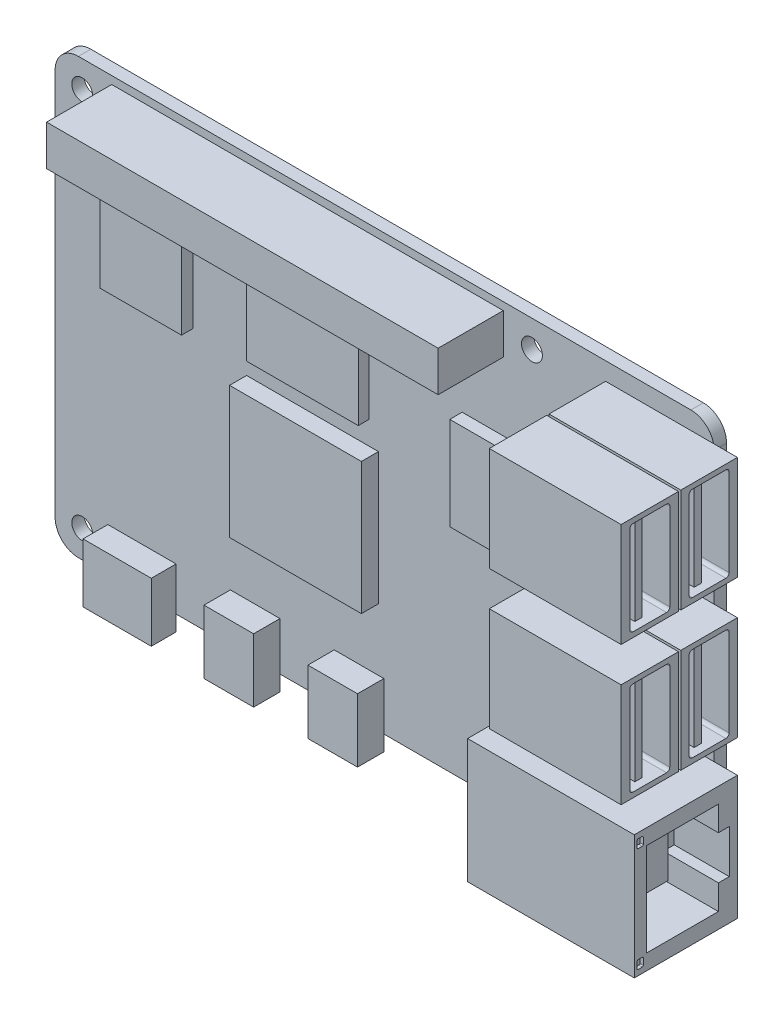
from build123d import *

# Parameters (mm, degrees)
PCB_LAMINATE_1P6_START                    = 5.5
PCB_85X56_R3_MOUNTPATTERN_R               = 1.35
PCB_LAMINATE_1P6_DEPTH                    = 1.6
USB_C_START                               = 7.1
USB_C_PROFILE_W                           = 8.8
USB_C_PROFILE_H                           = 7.6
USB_C_DEPTH                               = 3.2
MICRO_HDMI_1_START                        = 7.1
MICRO_HDMI_1_PROFILE_W                    = 6.4
MICRO_HDMI_1_PROFILE_H                    = 8.2
MICRO_HDMI_1_DEPTH                        = 3.4
MICRO_HDMI_2_START                        = 7.1
MICRO_HDMI_2_PROFILE_W                    = 6.4
MICRO_HDMI_2_PROFILE_H                    = 8.2
MICRO_HDMI_2_DEPTH                        = 3.4
RJ45_START                                = 7.1
RJ45_PROFILE_W                            = 21.5
RJ45_PROFILE_H                            = 16
RJ45_DEPTH                                = 13.3
USB_A_1_START                             = 7.1
USB_A_1_PROFILE_W                         = 17
USB_A_1_PROFILE_H                         = 13.4
USB_A_1_DEPTH                             = 7.3
USB_A_2_START                             = 14.7
USB_A_2_PROFILE_W                         = 17
USB_A_2_PROFILE_H                         = 13.4
USB_A_2_DEPTH                             = 7.4
USB_A_3_START                             = 7.1
USB_A_3_PROFILE_W                         = 17
USB_A_3_PROFILE_H                         = 13.4
USB_A_3_DEPTH                             = 7.3
USB_A_4_START                             = 14.7
USB_A_4_PROFILE_W                         = 17
USB_A_4_PROFILE_H                         = 13.4
USB_A_4_DEPTH                             = 7.4
BCM2712_START                             = 7.1
BCM2712_PROFILE_W                         = 17
BCM2712_PROFILE_H                         = 17
BCM2712_DEPTH                             = 2.2
RAM_START                                 = 7.1
RAM_PROFILE_W                             = 14.4
RAM_PROFILE_H                             = 10.1
RAM_DEPTH                                 = 1.4
RP1_START                                 = 7.1
RP1_PROFILE_W                             = 12
RP1_PROFILE_H                             = 12
RP1_DEPTH                                 = 1.6
POWER_IC_START                            = 7.1
POWER_IC_PROFILE_W                        = 10.5
POWER_IC_PROFILE_H                        = 13
POWER_IC_DEPTH                            = 1.5
GPIO_HEADER_START                         = 7.1
GPIO_HEADER_PROFILE_W                     = 50.5
GPIO_HEADER_PROFILE_H                     = 5.2
GPIO_HEADER_DEPTH                         = 8.4
DETAIL_USB_C_RECEPTACLE_START             = -30.08
DETAIL_USB_C_RECEPTACLE_DEPTH             = 4.45
DETAIL_MICRO_HDMI_KEYED_RECEPTACLES_START = -30.08
DETAIL_MICRO_HDMI_KEYED_RECEPTACLES_DEPTH = 4.35
DETAIL_USB_A_FOUR_RECEPTACLES_START       = 45.58
DETAIL_USB_A_FOUR_RECEPTACLES_DEPTH       = 6.28
DETAIL_RJ45_KEYED_RECEPTACLE_START        = 45.58
DETAIL_RJ45_KEYED_RECEPTACLE_DEPTH        = 7.18
DETAIL_RJ45_LED_POCKETS_START             = 45.58
DETAIL_RJ45_LED_POCKETS_DEPTH             = 1.12
USB_C_INSULATED_TONGUE_START              = 8.44
USB_C_INSULATED_TONGUE_PROFILE_W          = 5.52
USB_C_INSULATED_TONGUE_PROFILE_H          = 3.73
USB_C_INSULATED_TONGUE_DEPTH              = 0.52
USB_C_GOLD_CONTACT_ROW_START              = 8.96
USB_C_GOLD_CONTACT_ROW_PROFILE_W          = 0.24
USB_C_GOLD_CONTACT_ROW_PROFILE_H          = 1.71
USB_C_GOLD_CONTACT_ROW_DEPTH              = 0.08
USB_C_GOLD_CONTACT_ROW_2_DEPTH            = 0.08
USB_C_GOLD_CONTACT_ROW_3_DEPTH            = 0.08
USB_C_GOLD_CONTACT_ROW_4_DEPTH            = 0.08
USB_C_GOLD_CONTACT_ROW_5_DEPTH            = 0.08
USB_C_GOLD_CONTACT_ROW_6_DEPTH            = 0.08
USB_C_GOLD_CONTACT_ROW_7_DEPTH            = 0.08
USB_C_GOLD_CONTACT_ROW_8_DEPTH            = 0.08
MICRO_HDMI_1_TONGUE_START                 = 8.49
MICRO_HDMI_1_TONGUE_PROFILE_W             = 3.76
MICRO_HDMI_1_TONGUE_PROFILE_H             = 3.43
MICRO_HDMI_1_TONGUE_DEPTH                 = 0.43
MICRO_HDMI_2_TONGUE_START                 = 8.49
MICRO_HDMI_2_TONGUE_PROFILE_W             = 3.76
MICRO_HDMI_2_TONGUE_PROFILE_H             = 3.43
MICRO_HDMI_2_TONGUE_DEPTH                 = 0.43
MICRO_HDMI_GOLD_CONTACT_ROWS_START        = 8.92
MICRO_HDMI_GOLD_CONTACT_ROWS_PROFILE_W    = 0.19
MICRO_HDMI_GOLD_CONTACT_ROWS_PROFILE_H    = 1.67
MICRO_HDMI_GOLD_CONTACT_ROWS_DEPTH        = 0.065
MICRO_HDMI_GOLD_CONTACT_ROWS_2_DEPTH      = 0.065
MICRO_HDMI_GOLD_CONTACT_ROWS_3_DEPTH      = 0.065
MICRO_HDMI_GOLD_CONTACT_ROWS_4_DEPTH      = 0.065
MICRO_HDMI_GOLD_CONTACT_ROWS_5_DEPTH      = 0.065
MICRO_HDMI_GOLD_CONTACT_ROWS_6_DEPTH      = 0.065
MICRO_HDMI_GOLD_CONTACT_ROWS_7_DEPTH      = 0.065
MICRO_HDMI_GOLD_CONTACT_ROWS_8_DEPTH      = 0.065
MICRO_HDMI_GOLD_CONTACT_ROWS_9_DEPTH      = 0.065
MICRO_HDMI_GOLD_CONTACT_ROWS_10_DEPTH     = 0.065
MICRO_HDMI_GOLD_CONTACT_ROWS_11_DEPTH     = 0.065
MICRO_HDMI_GOLD_CONTACT_ROWS_12_DEPTH     = 0.065
MICRO_HDMI_GOLD_CONTACT_ROWS_13_DEPTH     = 0.065
MICRO_HDMI_GOLD_CONTACT_ROWS_14_DEPTH     = 0.065
USB_A_1_INSULATED_TONGUE_START            = 11.16
USB_A_1_INSULATED_TONGUE_PROFILE_W        = 5.52
USB_A_1_INSULATED_TONGUE_PROFILE_H        = 11.24
USB_A_1_INSULATED_TONGUE_DEPTH            = 0.92
USB_A_1_GOLD_CONTACT_ROW_START            = 11.05
USB_A_1_GOLD_CONTACT_ROW_PROFILE_W        = 2.2
USB_A_1_GOLD_CONTACT_ROW_PROFILE_H        = 0.7
USB_A_1_GOLD_CONTACT_ROW_DEPTH            = 0.11
USB_A_1_GOLD_CONTACT_ROW_2_DEPTH          = 0.11
USB_A_1_GOLD_CONTACT_ROW_3_DEPTH          = 0.11
USB_A_1_GOLD_CONTACT_ROW_4_DEPTH          = 0.11
USB_A_2_INSULATED_TONGUE_START            = 18.81
USB_A_2_INSULATED_TONGUE_PROFILE_W        = 5.52
USB_A_2_INSULATED_TONGUE_PROFILE_H        = 11.24
USB_A_2_INSULATED_TONGUE_DEPTH            = 0.92
USB_A_2_GOLD_CONTACT_ROW_START            = 18.7
USB_A_2_GOLD_CONTACT_ROW_PROFILE_W        = 2.2
USB_A_2_GOLD_CONTACT_ROW_PROFILE_H        = 0.7
USB_A_2_GOLD_CONTACT_ROW_DEPTH            = 0.11
USB_A_2_GOLD_CONTACT_ROW_2_DEPTH          = 0.11
USB_A_2_GOLD_CONTACT_ROW_3_DEPTH          = 0.11
USB_A_2_GOLD_CONTACT_ROW_4_DEPTH          = 0.11
USB_A_3_INSULATED_TONGUE_START            = 11.16
USB_A_3_INSULATED_TONGUE_PROFILE_W        = 5.52
USB_A_3_INSULATED_TONGUE_PROFILE_H        = 11.24
USB_A_3_INSULATED_TONGUE_DEPTH            = 0.92
USB_A_3_GOLD_CONTACT_ROW_START            = 11.05
USB_A_3_GOLD_CONTACT_ROW_PROFILE_W        = 2.2
USB_A_3_GOLD_CONTACT_ROW_PROFILE_H        = 0.7
USB_A_3_GOLD_CONTACT_ROW_DEPTH            = 0.11
USB_A_3_GOLD_CONTACT_ROW_2_DEPTH          = 0.11
USB_A_3_GOLD_CONTACT_ROW_3_DEPTH          = 0.11
USB_A_3_GOLD_CONTACT_ROW_4_DEPTH          = 0.11
USB_A_4_INSULATED_TONGUE_START            = 18.81
USB_A_4_INSULATED_TONGUE_PROFILE_W        = 5.52
USB_A_4_INSULATED_TONGUE_PROFILE_H        = 11.24
USB_A_4_INSULATED_TONGUE_DEPTH            = 0.92
USB_A_4_GOLD_CONTACT_ROW_START            = 18.7
USB_A_4_GOLD_CONTACT_ROW_PROFILE_W        = 2.2
USB_A_4_GOLD_CONTACT_ROW_PROFILE_H        = 0.7
USB_A_4_GOLD_CONTACT_ROW_DEPTH            = 0.11
USB_A_4_GOLD_CONTACT_ROW_2_DEPTH          = 0.11
USB_A_4_GOLD_CONTACT_ROW_3_DEPTH          = 0.11
USB_A_4_GOLD_CONTACT_ROW_4_DEPTH          = 0.11
RJ45_DARK_BACKPIECE_START                 = 9.62
RJ45_DARK_BACKPIECE_PROFILE_W             = 0.62
RJ45_DARK_BACKPIECE_PROFILE_H             = 11.5
RJ45_DARK_BACKPIECE_DEPTH                 = 9.06
RJ45_CONTACT_CARRIER_START                = 17.75
RJ45_CONTACT_CARRIER_PROFILE_W            = 4.93
RJ45_CONTACT_CARRIER_PROFILE_H            = 10
RJ45_CONTACT_CARRIER_DEPTH                = 0.7
RJ45_EIGHT_GOLD_CONTACTS_START            = 17.6
RJ45_EIGHT_GOLD_CONTACTS_PROFILE_W        = 4.18
RJ45_EIGHT_GOLD_CONTACTS_PROFILE_H        = 0.31
RJ45_EIGHT_GOLD_CONTACTS_DEPTH            = 0.15
RJ45_EIGHT_GOLD_CONTACTS_2_DEPTH          = 0.15
RJ45_EIGHT_GOLD_CONTACTS_3_DEPTH          = 0.15
RJ45_EIGHT_GOLD_CONTACTS_4_DEPTH          = 0.15
RJ45_EIGHT_GOLD_CONTACTS_5_DEPTH          = 0.15
RJ45_EIGHT_GOLD_CONTACTS_6_DEPTH          = 0.15
RJ45_EIGHT_GOLD_CONTACTS_7_DEPTH          = 0.15
RJ45_EIGHT_GOLD_CONTACTS_8_DEPTH          = 0.15
RJ45_GREEN_INDICATOR_START                = 19.37
RJ45_GREEN_INDICATOR_PROFILE_W            = 0.63
RJ45_GREEN_INDICATOR_PROFILE_H            = 0.86
RJ45_GREEN_INDICATOR_DEPTH                = 0.54
RJ45_AMBER_INDICATOR_START                = 19.37
RJ45_AMBER_INDICATOR_PROFILE_W            = 0.63
RJ45_AMBER_INDICATOR_PROFILE_H            = 0.86
RJ45_AMBER_INDICATOR_DEPTH                = 0.54


with BuildPart() as part:
    # PCB_85x56_R3_MountPattern → PCB_Laminate_1p6 (new body)
    with BuildSketch(Plane.XY.offset(PCB_LAMINATE_1P6_START)):
        with BuildLine():
            Line((-39.5, -28), (39.5, -28))
            ThreePointArc((39.5, -28), (41.621320344, -27.121320344), (42.5, -25))
            Line((42.5, -25), (42.5, 25))
            ThreePointArc((42.5, 25), (41.621320344, 27.121320344), (39.5, 28))
            Line((39.5, 28), (-39.5, 28))
            ThreePointArc((-39.5, 28), (-41.621320344, 27.121320344), (-42.5, 25))
            Line((-42.5, 25), (-42.5, -25))
            ThreePointArc((-42.5, -25), (-41.621320344, -27.121320344), (-39.5, -28))
        make_face()
        with Locations((-39, -24.5)):
            Circle(PCB_85X56_R3_MOUNTPATTERN_R, mode=Mode.SUBTRACT)
        with Locations((-39, 24.5)):
            Circle(PCB_85X56_R3_MOUNTPATTERN_R, mode=Mode.SUBTRACT)
        with Locations((19, -24.5)):
            Circle(PCB_85X56_R3_MOUNTPATTERN_R, mode=Mode.SUBTRACT)
        with Locations((19, 24.5)):
            Circle(PCB_85X56_R3_MOUNTPATTERN_R, mode=Mode.SUBTRACT)
    extrude(amount=PCB_LAMINATE_1P6_DEPTH)


with BuildPart() as body_2:
    # USB_C_Profile → USB_C (new body)
    with BuildSketch(Plane.XY.offset(USB_C_START)):
        with Locations((-31.3, -26.2)):
            Rectangle(USB_C_PROFILE_W, USB_C_PROFILE_H)
    extrude(amount=USB_C_DEPTH)

    # Detail_USB_C_Receptacle_Profile → Detail_USB_C_Receptacle (cut)
    with BuildSketch(Plane(origin=(0, 0, 0), x_dir=(1, 0, 0), z_dir=(0, 1, 0)).offset(DETAIL_USB_C_RECEPTACLE_START)):
        with BuildLine():
            Line((-34.04, -9.88), (-28.56, -9.88))
            ThreePointArc((-28.56, -9.88), (-27.753898269, -9.546101731), (-27.42, -8.74))
            Line((-27.42, -8.74), (-27.42, -8.66))
            ThreePointArc((-27.42, -8.66), (-27.753898269, -7.853898269), (-28.56, -7.52))
            Line((-28.56, -7.52), (-34.04, -7.52))
            ThreePointArc((-34.04, -7.52), (-34.846101731, -7.853898269), (-35.18, -8.66))
            Line((-35.18, -8.66), (-35.18, -8.74))
            ThreePointArc((-35.18, -8.74), (-34.846101731, -9.546101731), (-34.04, -9.88))
        make_face()
    extrude(amount=DETAIL_USB_C_RECEPTACLE_DEPTH, mode=Mode.SUBTRACT)


with BuildPart() as body_3:
    # Micro_HDMI_1_Profile → Micro_HDMI_1 (new body)
    with BuildSketch(Plane.XY.offset(MICRO_HDMI_1_START)):
        with Locations((-16.7, -25.9)):
            Rectangle(MICRO_HDMI_1_PROFILE_W, MICRO_HDMI_1_PROFILE_H)
    extrude(amount=MICRO_HDMI_1_DEPTH)


with BuildPart() as body_4:
    # Micro_HDMI_2_Profile → Micro_HDMI_2 (new body)
    with BuildSketch(Plane.XY.offset(MICRO_HDMI_2_START)):
        with Locations((-3.3, -25.9)):
            Rectangle(MICRO_HDMI_2_PROFILE_W, MICRO_HDMI_2_PROFILE_H)
    extrude(amount=MICRO_HDMI_2_DEPTH)


with BuildPart() as body_5:
    # RJ45_Profile → RJ45 (new body)
    with BuildSketch(Plane.XY.offset(RJ45_START)):
        with Locations((34.75, -17.8)):
            Rectangle(RJ45_PROFILE_W, RJ45_PROFILE_H)
    extrude(amount=RJ45_DEPTH)

    # Detail_RJ45_Keyed_Receptacle_Profile → Detail_RJ45_Keyed_Receptacle (cut)
    with BuildSketch(Plane(origin=(0, 0, 0), x_dir=(0, 0, -1), z_dir=(1, 0, 0)).offset(DETAIL_RJ45_KEYED_RECEPTACLE_START)):
        Polygon((-18.8, -23.8), (-18.8, -11.8), (-9.55, -11.8), (-9.55, -15), (-8.15, -15), (-8.15, -20.6), (-9.55, -20.6), (-9.55, -23.8), align=None)
    extrude(amount=-DETAIL_RJ45_KEYED_RECEPTACLE_DEPTH, mode=Mode.SUBTRACT)

    # Detail_RJ45_LED_Pockets_Profile → Detail_RJ45_LED_Pockets (cut)
    with BuildSketch(Plane(origin=(0, 0, 0), x_dir=(0, 0, -1), z_dir=(1, 0, 0)).offset(DETAIL_RJ45_LED_POCKETS_START)):
        with BuildLine():
            Line((-19.9, -25.1), (-19.38, -25.1))
            ThreePointArc((-19.38, -25.1), (-19.281005051, -25.058994949), (-19.24, -24.96))
            Line((-19.24, -24.96), (-19.24, -24.14))
            ThreePointArc((-19.24, -24.14), (-19.281005051, -24.041005051), (-19.38, -24))
            Line((-19.38, -24), (-19.9, -24))
            ThreePointArc((-19.9, -24), (-19.998994949, -24.041005051), (-20.04, -24.14))
            Line((-20.04, -24.14), (-20.04, -24.96))
            ThreePointArc((-20.04, -24.96), (-19.998994949, -25.058994949), (-19.9, -25.1))
        make_face()
        with BuildLine():
            Line((-19.9, -11.6), (-19.38, -11.6))
            ThreePointArc((-19.38, -11.6), (-19.281005051, -11.558994949), (-19.24, -11.46))
            Line((-19.24, -11.46), (-19.24, -10.64))
            ThreePointArc((-19.24, -10.64), (-19.281005051, -10.541005051), (-19.38, -10.5))
            Line((-19.38, -10.5), (-19.9, -10.5))
            ThreePointArc((-19.9, -10.5), (-19.998994949, -10.541005051), (-20.04, -10.64))
            Line((-20.04, -10.64), (-20.04, -11.46))
            ThreePointArc((-20.04, -11.46), (-19.998994949, -11.558994949), (-19.9, -11.6))
        make_face()
    extrude(amount=-DETAIL_RJ45_LED_POCKETS_DEPTH, mode=Mode.SUBTRACT)


with BuildPart() as body_6:
    # USB_A_1_Profile → USB_A_1 (new body)
    with BuildSketch(Plane.XY.offset(USB_A_1_START)):
        with Locations((37, 1.1)):
            Rectangle(USB_A_1_PROFILE_W, USB_A_1_PROFILE_H)
    extrude(amount=USB_A_1_DEPTH)


with BuildPart() as body_7:
    # USB_A_2_Profile → USB_A_2 (new body)
    with BuildSketch(Plane.XY.offset(USB_A_2_START)):
        with Locations((37, 1.1)):
            Rectangle(USB_A_2_PROFILE_W, USB_A_2_PROFILE_H)
    extrude(amount=USB_A_2_DEPTH)


with BuildPart() as body_8:
    # USB_A_3_Profile → USB_A_3 (new body)
    with BuildSketch(Plane.XY.offset(USB_A_3_START)):
        with Locations((37, 19)):
            Rectangle(USB_A_3_PROFILE_W, USB_A_3_PROFILE_H)
    extrude(amount=USB_A_3_DEPTH)


with BuildPart() as body_9:
    # USB_A_4_Profile → USB_A_4 (new body)
    with BuildSketch(Plane.XY.offset(USB_A_4_START)):
        with Locations((37, 19)):
            Rectangle(USB_A_4_PROFILE_W, USB_A_4_PROFILE_H)
    extrude(amount=USB_A_4_DEPTH)


with BuildPart() as body_10:
    # BCM2712_Profile → BCM2712 (new body)
    with BuildSketch(Plane.XY.offset(BCM2712_START)):
        with Locations((-9.3, -5.3)):
            Rectangle(BCM2712_PROFILE_W, BCM2712_PROFILE_H)
    extrude(amount=BCM2712_DEPTH)


with BuildPart() as body_11:
    # RAM_Profile → RAM (new body)
    with BuildSketch(Plane.XY.offset(RAM_START)):
        with Locations((-9.2, 11.25)):
            Rectangle(RAM_PROFILE_W, RAM_PROFILE_H)
    extrude(amount=RAM_DEPTH)


with BuildPart() as body_12:
    # RP1_Profile → RP1 (new body)
    with BuildSketch(Plane.XY.offset(RP1_START)):
        with Locations((16, 7)):
            Rectangle(RP1_PROFILE_W, RP1_PROFILE_H)
    extrude(amount=RP1_DEPTH)


with BuildPart() as body_13:
    # Power_IC_Profile → Power_IC (new body)
    with BuildSketch(Plane.XY.offset(POWER_IC_START)):
        with Locations((-29.95, 11.5)):
            Rectangle(POWER_IC_PROFILE_W, POWER_IC_PROFILE_H)
    extrude(amount=POWER_IC_DEPTH)


with BuildPart() as body_14:
    # GPIO_Header_Profile → GPIO_Header (new body)
    with BuildSketch(Plane.XY.offset(GPIO_HEADER_START)):
        with Locations((-9.95, 24.4)):
            Rectangle(GPIO_HEADER_PROFILE_W, GPIO_HEADER_PROFILE_H)
    extrude(amount=GPIO_HEADER_DEPTH)


with BuildPart() as detail_micro_hdmi_keyed_receptacles_tool:
    # Detail_Micro_HDMI_Keyed_Receptacles_Profile → Detail_Micro_HDMI_Keyed_Receptacles (new body)
    with BuildSketch(Plane(origin=(0, 0, 0), x_dir=(1, 0, 0), z_dir=(0, 1, 0)).offset(DETAIL_MICRO_HDMI_KEYED_RECEPTACLES_START)):
        Polygon((-19.45, -9.95), (-13.95, -9.95), (-13.95, -8.48), (-14.58, -7.65), (-18.82, -7.65), (-19.45, -8.48), align=None)
        Polygon((-6.05, -9.95), (-0.55, -9.95), (-0.55, -8.48), (-1.18, -7.65), (-5.42, -7.65), (-6.05, -8.48), align=None)
    extrude(amount=DETAIL_MICRO_HDMI_KEYED_RECEPTACLES_DEPTH)


with BuildPart() as body_3_1:
    add(body_3.part)

    # Detail_Micro_HDMI_Keyed_Receptacles: cut by detail_micro_hdmi_keyed_receptacles_tool
    add(detail_micro_hdmi_keyed_receptacles_tool.part, mode=Mode.SUBTRACT)


with BuildPart() as body_4_1:
    add(body_4.part)

    # Detail_Micro_HDMI_Keyed_Receptacles: cut by detail_micro_hdmi_keyed_receptacles_tool
    add(detail_micro_hdmi_keyed_receptacles_tool.part, mode=Mode.SUBTRACT)


with BuildPart() as detail_usb_a_four_receptacles_tool:
    # Detail_USB_A_Four_Receptacles_Profile → Detail_USB_A_Four_Receptacles (new body)
    with BuildSketch(Plane(origin=(0, 0, 0), x_dir=(0, 0, -1), z_dir=(1, 0, 0)).offset(DETAIL_USB_A_FOUR_RECEPTACLES_START)):
        with BuildLine():
            Line((-12.91, -4.95), (-8.59, -4.95))
            ThreePointArc((-8.59, -4.95), (-8.293015152, -4.826984848), (-8.17, -4.53))
            Line((-8.17, -4.53), (-8.17, 6.73))
            ThreePointArc((-8.17, 6.73), (-8.293015152, 7.026984848), (-8.59, 7.15))
            Line((-8.59, 7.15), (-12.91, 7.15))
            ThreePointArc((-12.91, 7.15), (-13.206984848, 7.026984848), (-13.33, 6.73))
            Line((-13.33, 6.73), (-13.33, -4.53))
            ThreePointArc((-13.33, -4.53), (-13.206984848, -4.826984848), (-12.91, -4.95))
        make_face()
        with BuildLine():
            Line((-20.56, -4.95), (-16.24, -4.95))
            ThreePointArc((-16.24, -4.95), (-15.943015152, -4.826984848), (-15.82, -4.53))
            Line((-15.82, -4.53), (-15.82, 6.73))
            ThreePointArc((-15.82, 6.73), (-15.943015152, 7.026984848), (-16.24, 7.15))
            Line((-16.24, 7.15), (-20.56, 7.15))
            ThreePointArc((-20.56, 7.15), (-20.856984848, 7.026984848), (-20.98, 6.73))
            Line((-20.98, 6.73), (-20.98, -4.53))
            ThreePointArc((-20.98, -4.53), (-20.856984848, -4.826984848), (-20.56, -4.95))
        make_face()
        with BuildLine():
            Line((-12.91, 12.95), (-8.59, 12.95))
            ThreePointArc((-8.59, 12.95), (-8.293015152, 13.073015152), (-8.17, 13.37))
            Line((-8.17, 13.37), (-8.17, 24.63))
            ThreePointArc((-8.17, 24.63), (-8.293015152, 24.926984848), (-8.59, 25.05))
            Line((-8.59, 25.05), (-12.91, 25.05))
            ThreePointArc((-12.91, 25.05), (-13.206984848, 24.926984848), (-13.33, 24.63))
            Line((-13.33, 24.63), (-13.33, 13.37))
            ThreePointArc((-13.33, 13.37), (-13.206984848, 13.073015152), (-12.91, 12.95))
        make_face()
        with BuildLine():
            Line((-20.56, 12.95), (-16.24, 12.95))
            ThreePointArc((-16.24, 12.95), (-15.943015152, 13.073015152), (-15.82, 13.37))
            Line((-15.82, 13.37), (-15.82, 24.63))
            ThreePointArc((-15.82, 24.63), (-15.943015152, 24.926984848), (-16.24, 25.05))
            Line((-16.24, 25.05), (-20.56, 25.05))
            ThreePointArc((-20.56, 25.05), (-20.856984848, 24.926984848), (-20.98, 24.63))
            Line((-20.98, 24.63), (-20.98, 13.37))
            ThreePointArc((-20.98, 13.37), (-20.856984848, 13.073015152), (-20.56, 12.95))
        make_face()
    extrude(amount=-DETAIL_USB_A_FOUR_RECEPTACLES_DEPTH)


with BuildPart() as body_6_1:
    add(body_6.part)

    # Detail_USB_A_Four_Receptacles: cut by detail_usb_a_four_receptacles_tool
    add(detail_usb_a_four_receptacles_tool.part, mode=Mode.SUBTRACT)


with BuildPart() as body_7_1:
    add(body_7.part)

    # Detail_USB_A_Four_Receptacles: cut by detail_usb_a_four_receptacles_tool
    add(detail_usb_a_four_receptacles_tool.part, mode=Mode.SUBTRACT)


with BuildPart() as body_8_1:
    add(body_8.part)

    # Detail_USB_A_Four_Receptacles: cut by detail_usb_a_four_receptacles_tool
    add(detail_usb_a_four_receptacles_tool.part, mode=Mode.SUBTRACT)


with BuildPart() as body_9_1:
    add(body_9.part)

    # Detail_USB_A_Four_Receptacles: cut by detail_usb_a_four_receptacles_tool
    add(detail_usb_a_four_receptacles_tool.part, mode=Mode.SUBTRACT)


with BuildPart() as body_15:
    # USB_C_Insulated_Tongue_Profile → USB_C_Insulated_Tongue (new body)
    with BuildSketch(Plane.XY.offset(USB_C_INSULATED_TONGUE_START)):
        with Locations((-31.3, -27.505)):
            Rectangle(USB_C_INSULATED_TONGUE_PROFILE_W, USB_C_INSULATED_TONGUE_PROFILE_H)
    extrude(amount=USB_C_INSULATED_TONGUE_DEPTH)


with BuildPart() as body_16:
    # USB_C_Gold_Contact_Row_Profile → USB_C_Gold_Contact_Row (new body)
    with BuildSketch(Plane.XY.offset(USB_C_GOLD_CONTACT_ROW_START)):
        with Locations((-33.365, -28.095)):
            Rectangle(USB_C_GOLD_CONTACT_ROW_PROFILE_W, USB_C_GOLD_CONTACT_ROW_PROFILE_H)
    extrude(amount=USB_C_GOLD_CONTACT_ROW_DEPTH)


with BuildPart() as body_17:
    # USB_C_Gold_Contact_Row_Profile → USB_C_Gold_Contact_Row 2 (new body)
    with BuildSketch(Plane.XY.offset(USB_C_GOLD_CONTACT_ROW_START)):
        with Locations((-32.775, -28.095)):
            Rectangle(USB_C_GOLD_CONTACT_ROW_PROFILE_W, USB_C_GOLD_CONTACT_ROW_PROFILE_H)
    extrude(amount=USB_C_GOLD_CONTACT_ROW_2_DEPTH)


with BuildPart() as body_18:
    # USB_C_Gold_Contact_Row_Profile → USB_C_Gold_Contact_Row 3 (new body)
    with BuildSketch(Plane.XY.offset(USB_C_GOLD_CONTACT_ROW_START)):
        with Locations((-32.185, -28.095)):
            Rectangle(USB_C_GOLD_CONTACT_ROW_PROFILE_W, USB_C_GOLD_CONTACT_ROW_PROFILE_H)
    extrude(amount=USB_C_GOLD_CONTACT_ROW_3_DEPTH)


with BuildPart() as body_19:
    # USB_C_Gold_Contact_Row_Profile → USB_C_Gold_Contact_Row 4 (new body)
    with BuildSketch(Plane.XY.offset(USB_C_GOLD_CONTACT_ROW_START)):
        with Locations((-31.595, -28.095)):
            Rectangle(USB_C_GOLD_CONTACT_ROW_PROFILE_W, USB_C_GOLD_CONTACT_ROW_PROFILE_H)
    extrude(amount=USB_C_GOLD_CONTACT_ROW_4_DEPTH)


with BuildPart() as body_20:
    # USB_C_Gold_Contact_Row_Profile → USB_C_Gold_Contact_Row 5 (new body)
    with BuildSketch(Plane.XY.offset(USB_C_GOLD_CONTACT_ROW_START)):
        with Locations((-31.005, -28.095)):
            Rectangle(USB_C_GOLD_CONTACT_ROW_PROFILE_W, USB_C_GOLD_CONTACT_ROW_PROFILE_H)
    extrude(amount=USB_C_GOLD_CONTACT_ROW_5_DEPTH)


with BuildPart() as body_21:
    # USB_C_Gold_Contact_Row_Profile → USB_C_Gold_Contact_Row 6 (new body)
    with BuildSketch(Plane.XY.offset(USB_C_GOLD_CONTACT_ROW_START)):
        with Locations((-30.415, -28.095)):
            Rectangle(USB_C_GOLD_CONTACT_ROW_PROFILE_W, USB_C_GOLD_CONTACT_ROW_PROFILE_H)
    extrude(amount=USB_C_GOLD_CONTACT_ROW_6_DEPTH)


with BuildPart() as body_22:
    # USB_C_Gold_Contact_Row_Profile → USB_C_Gold_Contact_Row 7 (new body)
    with BuildSketch(Plane.XY.offset(USB_C_GOLD_CONTACT_ROW_START)):
        with Locations((-29.825, -28.095)):
            Rectangle(USB_C_GOLD_CONTACT_ROW_PROFILE_W, USB_C_GOLD_CONTACT_ROW_PROFILE_H)
    extrude(amount=USB_C_GOLD_CONTACT_ROW_7_DEPTH)


with BuildPart() as body_23:
    # USB_C_Gold_Contact_Row_Profile → USB_C_Gold_Contact_Row 8 (new body)
    with BuildSketch(Plane.XY.offset(USB_C_GOLD_CONTACT_ROW_START)):
        with Locations((-29.235, -28.095)):
            Rectangle(USB_C_GOLD_CONTACT_ROW_PROFILE_W, USB_C_GOLD_CONTACT_ROW_PROFILE_H)
    extrude(amount=USB_C_GOLD_CONTACT_ROW_8_DEPTH)


with BuildPart() as body_24:
    # Micro_HDMI_1_Tongue_Profile → Micro_HDMI_1_Tongue (new body)
    with BuildSketch(Plane.XY.offset(MICRO_HDMI_1_TONGUE_START)):
        with Locations((-16.7, -27.465)):
            Rectangle(MICRO_HDMI_1_TONGUE_PROFILE_W, MICRO_HDMI_1_TONGUE_PROFILE_H)
    extrude(amount=MICRO_HDMI_1_TONGUE_DEPTH)


with BuildPart() as body_25:
    # Micro_HDMI_2_Tongue_Profile → Micro_HDMI_2_Tongue (new body)
    with BuildSketch(Plane.XY.offset(MICRO_HDMI_2_TONGUE_START)):
        with Locations((-3.3, -27.465)):
            Rectangle(MICRO_HDMI_2_TONGUE_PROFILE_W, MICRO_HDMI_2_TONGUE_PROFILE_H)
    extrude(amount=MICRO_HDMI_2_TONGUE_DEPTH)


with BuildPart() as body_26:
    # Micro_HDMI_Gold_Contact_Rows_Profile → Micro_HDMI_Gold_Contact_Rows (new body)
    with BuildSketch(Plane.XY.offset(MICRO_HDMI_GOLD_CONTACT_ROWS_START)):
        with Locations((-18.11, -28.085)):
            Rectangle(MICRO_HDMI_GOLD_CONTACT_ROWS_PROFILE_W, MICRO_HDMI_GOLD_CONTACT_ROWS_PROFILE_H)
    extrude(amount=MICRO_HDMI_GOLD_CONTACT_ROWS_DEPTH)


with BuildPart() as body_27:
    # Micro_HDMI_Gold_Contact_Rows_Profile → Micro_HDMI_Gold_Contact_Rows 2 (new body)
    with BuildSketch(Plane.XY.offset(MICRO_HDMI_GOLD_CONTACT_ROWS_START)):
        with Locations((-17.64, -28.085)):
            Rectangle(MICRO_HDMI_GOLD_CONTACT_ROWS_PROFILE_W, MICRO_HDMI_GOLD_CONTACT_ROWS_PROFILE_H)
    extrude(amount=MICRO_HDMI_GOLD_CONTACT_ROWS_2_DEPTH)


with BuildPart() as body_28:
    # Micro_HDMI_Gold_Contact_Rows_Profile → Micro_HDMI_Gold_Contact_Rows 3 (new body)
    with BuildSketch(Plane.XY.offset(MICRO_HDMI_GOLD_CONTACT_ROWS_START)):
        with Locations((-17.17, -28.085)):
            Rectangle(MICRO_HDMI_GOLD_CONTACT_ROWS_PROFILE_W, MICRO_HDMI_GOLD_CONTACT_ROWS_PROFILE_H)
    extrude(amount=MICRO_HDMI_GOLD_CONTACT_ROWS_3_DEPTH)


with BuildPart() as body_29:
    # Micro_HDMI_Gold_Contact_Rows_Profile → Micro_HDMI_Gold_Contact_Rows 4 (new body)
    with BuildSketch(Plane.XY.offset(MICRO_HDMI_GOLD_CONTACT_ROWS_START)):
        with Locations((-16.7, -28.085)):
            Rectangle(MICRO_HDMI_GOLD_CONTACT_ROWS_PROFILE_W, MICRO_HDMI_GOLD_CONTACT_ROWS_PROFILE_H)
    extrude(amount=MICRO_HDMI_GOLD_CONTACT_ROWS_4_DEPTH)


with BuildPart() as body_30:
    # Micro_HDMI_Gold_Contact_Rows_Profile → Micro_HDMI_Gold_Contact_Rows 5 (new body)
    with BuildSketch(Plane.XY.offset(MICRO_HDMI_GOLD_CONTACT_ROWS_START)):
        with Locations((-16.23, -28.085)):
            Rectangle(MICRO_HDMI_GOLD_CONTACT_ROWS_PROFILE_W, MICRO_HDMI_GOLD_CONTACT_ROWS_PROFILE_H)
    extrude(amount=MICRO_HDMI_GOLD_CONTACT_ROWS_5_DEPTH)


with BuildPart() as body_31:
    # Micro_HDMI_Gold_Contact_Rows_Profile → Micro_HDMI_Gold_Contact_Rows 6 (new body)
    with BuildSketch(Plane.XY.offset(MICRO_HDMI_GOLD_CONTACT_ROWS_START)):
        with Locations((-15.76, -28.085)):
            Rectangle(MICRO_HDMI_GOLD_CONTACT_ROWS_PROFILE_W, MICRO_HDMI_GOLD_CONTACT_ROWS_PROFILE_H)
    extrude(amount=MICRO_HDMI_GOLD_CONTACT_ROWS_6_DEPTH)


with BuildPart() as body_32:
    # Micro_HDMI_Gold_Contact_Rows_Profile → Micro_HDMI_Gold_Contact_Rows 7 (new body)
    with BuildSketch(Plane.XY.offset(MICRO_HDMI_GOLD_CONTACT_ROWS_START)):
        with Locations((-15.29, -28.085)):
            Rectangle(MICRO_HDMI_GOLD_CONTACT_ROWS_PROFILE_W, MICRO_HDMI_GOLD_CONTACT_ROWS_PROFILE_H)
    extrude(amount=MICRO_HDMI_GOLD_CONTACT_ROWS_7_DEPTH)


with BuildPart() as body_33:
    # Micro_HDMI_Gold_Contact_Rows_Profile → Micro_HDMI_Gold_Contact_Rows 8 (new body)
    with BuildSketch(Plane.XY.offset(MICRO_HDMI_GOLD_CONTACT_ROWS_START)):
        with Locations((-4.71, -28.085)):
            Rectangle(MICRO_HDMI_GOLD_CONTACT_ROWS_PROFILE_W, MICRO_HDMI_GOLD_CONTACT_ROWS_PROFILE_H)
    extrude(amount=MICRO_HDMI_GOLD_CONTACT_ROWS_8_DEPTH)


with BuildPart() as body_34:
    # Micro_HDMI_Gold_Contact_Rows_Profile → Micro_HDMI_Gold_Contact_Rows 9 (new body)
    with BuildSketch(Plane.XY.offset(MICRO_HDMI_GOLD_CONTACT_ROWS_START)):
        with Locations((-4.24, -28.085)):
            Rectangle(MICRO_HDMI_GOLD_CONTACT_ROWS_PROFILE_W, MICRO_HDMI_GOLD_CONTACT_ROWS_PROFILE_H)
    extrude(amount=MICRO_HDMI_GOLD_CONTACT_ROWS_9_DEPTH)


with BuildPart() as body_35:
    # Micro_HDMI_Gold_Contact_Rows_Profile → Micro_HDMI_Gold_Contact_Rows 10 (new body)
    with BuildSketch(Plane.XY.offset(MICRO_HDMI_GOLD_CONTACT_ROWS_START)):
        with Locations((-3.77, -28.085)):
            Rectangle(MICRO_HDMI_GOLD_CONTACT_ROWS_PROFILE_W, MICRO_HDMI_GOLD_CONTACT_ROWS_PROFILE_H)
    extrude(amount=MICRO_HDMI_GOLD_CONTACT_ROWS_10_DEPTH)


with BuildPart() as body_36:
    # Micro_HDMI_Gold_Contact_Rows_Profile → Micro_HDMI_Gold_Contact_Rows 11 (new body)
    with BuildSketch(Plane.XY.offset(MICRO_HDMI_GOLD_CONTACT_ROWS_START)):
        with Locations((-3.3, -28.085)):
            Rectangle(MICRO_HDMI_GOLD_CONTACT_ROWS_PROFILE_W, MICRO_HDMI_GOLD_CONTACT_ROWS_PROFILE_H)
    extrude(amount=MICRO_HDMI_GOLD_CONTACT_ROWS_11_DEPTH)


with BuildPart() as body_37:
    # Micro_HDMI_Gold_Contact_Rows_Profile → Micro_HDMI_Gold_Contact_Rows 12 (new body)
    with BuildSketch(Plane.XY.offset(MICRO_HDMI_GOLD_CONTACT_ROWS_START)):
        with Locations((-2.83, -28.085)):
            Rectangle(MICRO_HDMI_GOLD_CONTACT_ROWS_PROFILE_W, MICRO_HDMI_GOLD_CONTACT_ROWS_PROFILE_H)
    extrude(amount=MICRO_HDMI_GOLD_CONTACT_ROWS_12_DEPTH)


with BuildPart() as body_38:
    # Micro_HDMI_Gold_Contact_Rows_Profile → Micro_HDMI_Gold_Contact_Rows 13 (new body)
    with BuildSketch(Plane.XY.offset(MICRO_HDMI_GOLD_CONTACT_ROWS_START)):
        with Locations((-2.36, -28.085)):
            Rectangle(MICRO_HDMI_GOLD_CONTACT_ROWS_PROFILE_W, MICRO_HDMI_GOLD_CONTACT_ROWS_PROFILE_H)
    extrude(amount=MICRO_HDMI_GOLD_CONTACT_ROWS_13_DEPTH)


with BuildPart() as body_39:
    # Micro_HDMI_Gold_Contact_Rows_Profile → Micro_HDMI_Gold_Contact_Rows 14 (new body)
    with BuildSketch(Plane.XY.offset(MICRO_HDMI_GOLD_CONTACT_ROWS_START)):
        with Locations((-1.89, -28.085)):
            Rectangle(MICRO_HDMI_GOLD_CONTACT_ROWS_PROFILE_W, MICRO_HDMI_GOLD_CONTACT_ROWS_PROFILE_H)
    extrude(amount=MICRO_HDMI_GOLD_CONTACT_ROWS_14_DEPTH)


with BuildPart() as body_40:
    # USB_A_1_Insulated_Tongue_Profile → USB_A_1_Insulated_Tongue (new body)
    with BuildSketch(Plane.XY.offset(USB_A_1_INSULATED_TONGUE_START)):
        with Locations((42.14, 1.1)):
            Rectangle(USB_A_1_INSULATED_TONGUE_PROFILE_W, USB_A_1_INSULATED_TONGUE_PROFILE_H)
    extrude(amount=USB_A_1_INSULATED_TONGUE_DEPTH)


with BuildPart() as body_41:
    # USB_A_1_Gold_Contact_Row_Profile → USB_A_1_Gold_Contact_Row (new body)
    with BuildSketch(Plane.XY.offset(USB_A_1_GOLD_CONTACT_ROW_START)):
        with Locations((43.4, -1.99)):
            Rectangle(USB_A_1_GOLD_CONTACT_ROW_PROFILE_W, USB_A_1_GOLD_CONTACT_ROW_PROFILE_H)
    extrude(amount=USB_A_1_GOLD_CONTACT_ROW_DEPTH)


with BuildPart() as body_42:
    # USB_A_1_Gold_Contact_Row_Profile → USB_A_1_Gold_Contact_Row 2 (new body)
    with BuildSketch(Plane.XY.offset(USB_A_1_GOLD_CONTACT_ROW_START)):
        with Locations((43.4, 0.07)):
            Rectangle(USB_A_1_GOLD_CONTACT_ROW_PROFILE_W, USB_A_1_GOLD_CONTACT_ROW_PROFILE_H)
    extrude(amount=USB_A_1_GOLD_CONTACT_ROW_2_DEPTH)


with BuildPart() as body_43:
    # USB_A_1_Gold_Contact_Row_Profile → USB_A_1_Gold_Contact_Row 3 (new body)
    with BuildSketch(Plane.XY.offset(USB_A_1_GOLD_CONTACT_ROW_START)):
        with Locations((43.4, 2.13)):
            Rectangle(USB_A_1_GOLD_CONTACT_ROW_PROFILE_W, USB_A_1_GOLD_CONTACT_ROW_PROFILE_H)
    extrude(amount=USB_A_1_GOLD_CONTACT_ROW_3_DEPTH)


with BuildPart() as body_44:
    # USB_A_1_Gold_Contact_Row_Profile → USB_A_1_Gold_Contact_Row 4 (new body)
    with BuildSketch(Plane.XY.offset(USB_A_1_GOLD_CONTACT_ROW_START)):
        with Locations((43.4, 4.19)):
            Rectangle(USB_A_1_GOLD_CONTACT_ROW_PROFILE_W, USB_A_1_GOLD_CONTACT_ROW_PROFILE_H)
    extrude(amount=USB_A_1_GOLD_CONTACT_ROW_4_DEPTH)


with BuildPart() as body_45:
    # USB_A_2_Insulated_Tongue_Profile → USB_A_2_Insulated_Tongue (new body)
    with BuildSketch(Plane.XY.offset(USB_A_2_INSULATED_TONGUE_START)):
        with Locations((42.14, 1.1)):
            Rectangle(USB_A_2_INSULATED_TONGUE_PROFILE_W, USB_A_2_INSULATED_TONGUE_PROFILE_H)
    extrude(amount=USB_A_2_INSULATED_TONGUE_DEPTH)


with BuildPart() as body_46:
    # USB_A_2_Gold_Contact_Row_Profile → USB_A_2_Gold_Contact_Row (new body)
    with BuildSketch(Plane.XY.offset(USB_A_2_GOLD_CONTACT_ROW_START)):
        with Locations((43.4, -1.99)):
            Rectangle(USB_A_2_GOLD_CONTACT_ROW_PROFILE_W, USB_A_2_GOLD_CONTACT_ROW_PROFILE_H)
    extrude(amount=USB_A_2_GOLD_CONTACT_ROW_DEPTH)


with BuildPart() as body_47:
    # USB_A_2_Gold_Contact_Row_Profile → USB_A_2_Gold_Contact_Row 2 (new body)
    with BuildSketch(Plane.XY.offset(USB_A_2_GOLD_CONTACT_ROW_START)):
        with Locations((43.4, 0.07)):
            Rectangle(USB_A_2_GOLD_CONTACT_ROW_PROFILE_W, USB_A_2_GOLD_CONTACT_ROW_PROFILE_H)
    extrude(amount=USB_A_2_GOLD_CONTACT_ROW_2_DEPTH)


with BuildPart() as body_48:
    # USB_A_2_Gold_Contact_Row_Profile → USB_A_2_Gold_Contact_Row 3 (new body)
    with BuildSketch(Plane.XY.offset(USB_A_2_GOLD_CONTACT_ROW_START)):
        with Locations((43.4, 2.13)):
            Rectangle(USB_A_2_GOLD_CONTACT_ROW_PROFILE_W, USB_A_2_GOLD_CONTACT_ROW_PROFILE_H)
    extrude(amount=USB_A_2_GOLD_CONTACT_ROW_3_DEPTH)


with BuildPart() as body_49:
    # USB_A_2_Gold_Contact_Row_Profile → USB_A_2_Gold_Contact_Row 4 (new body)
    with BuildSketch(Plane.XY.offset(USB_A_2_GOLD_CONTACT_ROW_START)):
        with Locations((43.4, 4.19)):
            Rectangle(USB_A_2_GOLD_CONTACT_ROW_PROFILE_W, USB_A_2_GOLD_CONTACT_ROW_PROFILE_H)
    extrude(amount=USB_A_2_GOLD_CONTACT_ROW_4_DEPTH)


with BuildPart() as body_50:
    # USB_A_3_Insulated_Tongue_Profile → USB_A_3_Insulated_Tongue (new body)
    with BuildSketch(Plane.XY.offset(USB_A_3_INSULATED_TONGUE_START)):
        with Locations((42.14, 19)):
            Rectangle(USB_A_3_INSULATED_TONGUE_PROFILE_W, USB_A_3_INSULATED_TONGUE_PROFILE_H)
    extrude(amount=USB_A_3_INSULATED_TONGUE_DEPTH)


with BuildPart() as body_51:
    # USB_A_3_Gold_Contact_Row_Profile → USB_A_3_Gold_Contact_Row (new body)
    with BuildSketch(Plane.XY.offset(USB_A_3_GOLD_CONTACT_ROW_START)):
        with Locations((43.4, 15.91)):
            Rectangle(USB_A_3_GOLD_CONTACT_ROW_PROFILE_W, USB_A_3_GOLD_CONTACT_ROW_PROFILE_H)
    extrude(amount=USB_A_3_GOLD_CONTACT_ROW_DEPTH)


with BuildPart() as body_52:
    # USB_A_3_Gold_Contact_Row_Profile → USB_A_3_Gold_Contact_Row 2 (new body)
    with BuildSketch(Plane.XY.offset(USB_A_3_GOLD_CONTACT_ROW_START)):
        with Locations((43.4, 17.97)):
            Rectangle(USB_A_3_GOLD_CONTACT_ROW_PROFILE_W, USB_A_3_GOLD_CONTACT_ROW_PROFILE_H)
    extrude(amount=USB_A_3_GOLD_CONTACT_ROW_2_DEPTH)


with BuildPart() as body_53:
    # USB_A_3_Gold_Contact_Row_Profile → USB_A_3_Gold_Contact_Row 3 (new body)
    with BuildSketch(Plane.XY.offset(USB_A_3_GOLD_CONTACT_ROW_START)):
        with Locations((43.4, 20.03)):
            Rectangle(USB_A_3_GOLD_CONTACT_ROW_PROFILE_W, USB_A_3_GOLD_CONTACT_ROW_PROFILE_H)
    extrude(amount=USB_A_3_GOLD_CONTACT_ROW_3_DEPTH)


with BuildPart() as body_54:
    # USB_A_3_Gold_Contact_Row_Profile → USB_A_3_Gold_Contact_Row 4 (new body)
    with BuildSketch(Plane.XY.offset(USB_A_3_GOLD_CONTACT_ROW_START)):
        with Locations((43.4, 22.09)):
            Rectangle(USB_A_3_GOLD_CONTACT_ROW_PROFILE_W, USB_A_3_GOLD_CONTACT_ROW_PROFILE_H)
    extrude(amount=USB_A_3_GOLD_CONTACT_ROW_4_DEPTH)


with BuildPart() as body_55:
    # USB_A_4_Insulated_Tongue_Profile → USB_A_4_Insulated_Tongue (new body)
    with BuildSketch(Plane.XY.offset(USB_A_4_INSULATED_TONGUE_START)):
        with Locations((42.14, 19)):
            Rectangle(USB_A_4_INSULATED_TONGUE_PROFILE_W, USB_A_4_INSULATED_TONGUE_PROFILE_H)
    extrude(amount=USB_A_4_INSULATED_TONGUE_DEPTH)


with BuildPart() as body_56:
    # USB_A_4_Gold_Contact_Row_Profile → USB_A_4_Gold_Contact_Row (new body)
    with BuildSketch(Plane.XY.offset(USB_A_4_GOLD_CONTACT_ROW_START)):
        with Locations((43.4, 15.91)):
            Rectangle(USB_A_4_GOLD_CONTACT_ROW_PROFILE_W, USB_A_4_GOLD_CONTACT_ROW_PROFILE_H)
    extrude(amount=USB_A_4_GOLD_CONTACT_ROW_DEPTH)


with BuildPart() as body_57:
    # USB_A_4_Gold_Contact_Row_Profile → USB_A_4_Gold_Contact_Row 2 (new body)
    with BuildSketch(Plane.XY.offset(USB_A_4_GOLD_CONTACT_ROW_START)):
        with Locations((43.4, 17.97)):
            Rectangle(USB_A_4_GOLD_CONTACT_ROW_PROFILE_W, USB_A_4_GOLD_CONTACT_ROW_PROFILE_H)
    extrude(amount=USB_A_4_GOLD_CONTACT_ROW_2_DEPTH)


with BuildPart() as body_58:
    # USB_A_4_Gold_Contact_Row_Profile → USB_A_4_Gold_Contact_Row 3 (new body)
    with BuildSketch(Plane.XY.offset(USB_A_4_GOLD_CONTACT_ROW_START)):
        with Locations((43.4, 20.03)):
            Rectangle(USB_A_4_GOLD_CONTACT_ROW_PROFILE_W, USB_A_4_GOLD_CONTACT_ROW_PROFILE_H)
    extrude(amount=USB_A_4_GOLD_CONTACT_ROW_3_DEPTH)


with BuildPart() as body_59:
    # USB_A_4_Gold_Contact_Row_Profile → USB_A_4_Gold_Contact_Row 4 (new body)
    with BuildSketch(Plane.XY.offset(USB_A_4_GOLD_CONTACT_ROW_START)):
        with Locations((43.4, 22.09)):
            Rectangle(USB_A_4_GOLD_CONTACT_ROW_PROFILE_W, USB_A_4_GOLD_CONTACT_ROW_PROFILE_H)
    extrude(amount=USB_A_4_GOLD_CONTACT_ROW_4_DEPTH)


with BuildPart() as body_60:
    # RJ45_Dark_Backpiece_Profile → RJ45_Dark_Backpiece (new body)
    with BuildSketch(Plane.XY.offset(RJ45_DARK_BACKPIECE_START)):
        with Locations((38.74, -17.8)):
            Rectangle(RJ45_DARK_BACKPIECE_PROFILE_W, RJ45_DARK_BACKPIECE_PROFILE_H)
    extrude(amount=RJ45_DARK_BACKPIECE_DEPTH)


with BuildPart() as body_61:
    # RJ45_Contact_Carrier_Profile → RJ45_Contact_Carrier (new body)
    with BuildSketch(Plane.XY.offset(RJ45_CONTACT_CARRIER_START)):
        with Locations((41.515, -17.8)):
            Rectangle(RJ45_CONTACT_CARRIER_PROFILE_W, RJ45_CONTACT_CARRIER_PROFILE_H)
    extrude(amount=RJ45_CONTACT_CARRIER_DEPTH)


with BuildPart() as body_62:
    # RJ45_Eight_Gold_Contacts_Profile → RJ45_Eight_Gold_Contacts (new body)
    with BuildSketch(Plane.XY.offset(RJ45_EIGHT_GOLD_CONTACTS_START)):
        with Locations((42.19, -21.195)):
            Rectangle(RJ45_EIGHT_GOLD_CONTACTS_PROFILE_W, RJ45_EIGHT_GOLD_CONTACTS_PROFILE_H)
    extrude(amount=RJ45_EIGHT_GOLD_CONTACTS_DEPTH)


with BuildPart() as body_63:
    # RJ45_Eight_Gold_Contacts_Profile → RJ45_Eight_Gold_Contacts 2 (new body)
    with BuildSketch(Plane.XY.offset(RJ45_EIGHT_GOLD_CONTACTS_START)):
        with Locations((42.19, -20.225)):
            Rectangle(RJ45_EIGHT_GOLD_CONTACTS_PROFILE_W, RJ45_EIGHT_GOLD_CONTACTS_PROFILE_H)
    extrude(amount=RJ45_EIGHT_GOLD_CONTACTS_2_DEPTH)


with BuildPart() as body_64:
    # RJ45_Eight_Gold_Contacts_Profile → RJ45_Eight_Gold_Contacts 3 (new body)
    with BuildSketch(Plane.XY.offset(RJ45_EIGHT_GOLD_CONTACTS_START)):
        with Locations((42.19, -19.255)):
            Rectangle(RJ45_EIGHT_GOLD_CONTACTS_PROFILE_W, RJ45_EIGHT_GOLD_CONTACTS_PROFILE_H)
    extrude(amount=RJ45_EIGHT_GOLD_CONTACTS_3_DEPTH)


with BuildPart() as body_65:
    # RJ45_Eight_Gold_Contacts_Profile → RJ45_Eight_Gold_Contacts 4 (new body)
    with BuildSketch(Plane.XY.offset(RJ45_EIGHT_GOLD_CONTACTS_START)):
        with Locations((42.19, -18.285)):
            Rectangle(RJ45_EIGHT_GOLD_CONTACTS_PROFILE_W, RJ45_EIGHT_GOLD_CONTACTS_PROFILE_H)
    extrude(amount=RJ45_EIGHT_GOLD_CONTACTS_4_DEPTH)


with BuildPart() as body_66:
    # RJ45_Eight_Gold_Contacts_Profile → RJ45_Eight_Gold_Contacts 5 (new body)
    with BuildSketch(Plane.XY.offset(RJ45_EIGHT_GOLD_CONTACTS_START)):
        with Locations((42.19, -17.315)):
            Rectangle(RJ45_EIGHT_GOLD_CONTACTS_PROFILE_W, RJ45_EIGHT_GOLD_CONTACTS_PROFILE_H)
    extrude(amount=RJ45_EIGHT_GOLD_CONTACTS_5_DEPTH)


with BuildPart() as body_67:
    # RJ45_Eight_Gold_Contacts_Profile → RJ45_Eight_Gold_Contacts 6 (new body)
    with BuildSketch(Plane.XY.offset(RJ45_EIGHT_GOLD_CONTACTS_START)):
        with Locations((42.19, -16.345)):
            Rectangle(RJ45_EIGHT_GOLD_CONTACTS_PROFILE_W, RJ45_EIGHT_GOLD_CONTACTS_PROFILE_H)
    extrude(amount=RJ45_EIGHT_GOLD_CONTACTS_6_DEPTH)


with BuildPart() as body_68:
    # RJ45_Eight_Gold_Contacts_Profile → RJ45_Eight_Gold_Contacts 7 (new body)
    with BuildSketch(Plane.XY.offset(RJ45_EIGHT_GOLD_CONTACTS_START)):
        with Locations((42.19, -15.375)):
            Rectangle(RJ45_EIGHT_GOLD_CONTACTS_PROFILE_W, RJ45_EIGHT_GOLD_CONTACTS_PROFILE_H)
    extrude(amount=RJ45_EIGHT_GOLD_CONTACTS_7_DEPTH)


with BuildPart() as body_69:
    # RJ45_Eight_Gold_Contacts_Profile → RJ45_Eight_Gold_Contacts 8 (new body)
    with BuildSketch(Plane.XY.offset(RJ45_EIGHT_GOLD_CONTACTS_START)):
        with Locations((42.19, -14.405)):
            Rectangle(RJ45_EIGHT_GOLD_CONTACTS_PROFILE_W, RJ45_EIGHT_GOLD_CONTACTS_PROFILE_H)
    extrude(amount=RJ45_EIGHT_GOLD_CONTACTS_8_DEPTH)


with BuildPart() as body_70:
    # RJ45_Green_Indicator_Profile → RJ45_Green_Indicator (new body)
    with BuildSketch(Plane.XY.offset(RJ45_GREEN_INDICATOR_START)):
        with Locations((44.865, -24.55)):
            Rectangle(RJ45_GREEN_INDICATOR_PROFILE_W, RJ45_GREEN_INDICATOR_PROFILE_H)
    extrude(amount=RJ45_GREEN_INDICATOR_DEPTH)


with BuildPart() as body_71:
    # RJ45_Amber_Indicator_Profile → RJ45_Amber_Indicator (new body)
    with BuildSketch(Plane.XY.offset(RJ45_AMBER_INDICATOR_START)):
        with Locations((44.865, -11.05)):
            Rectangle(RJ45_AMBER_INDICATOR_PROFILE_W, RJ45_AMBER_INDICATOR_PROFILE_H)
    extrude(amount=RJ45_AMBER_INDICATOR_DEPTH)


solid = Compound([part.part, body_2.part, body_5.part, body_10.part, body_11.part, body_12.part, body_13.part, body_14.part, body_3_1.part, body_4_1.part, body_6_1.part, body_7_1.part, body_8_1.part, body_9_1.part, body_15.part, body_16.part, body_17.part, body_18.part, body_19.part, body_20.part, body_21.part, body_22.part, body_23.part, body_24.part, body_25.part, body_26.part, body_27.part, body_28.part, body_29.part, body_30.part, body_31.part, body_32.part, body_33.part, body_34.part, body_35.part, body_36.part, body_37.part, body_38.part, body_39.part, body_40.part, body_41.part, body_42.part, body_43.part, body_44.part, body_45.part, body_46.part, body_47.part, body_48.part, body_49.part, body_50.part, body_51.part, body_52.part, body_53.part, body_54.part, body_55.part, body_56.part, body_57.part, body_58.part, body_59.part, body_60.part, body_61.part, body_62.part, body_63.part, body_64.part, body_65.part, body_66.part, body_67.part, body_68.part, body_69.part, body_70.part, body_71.part])
